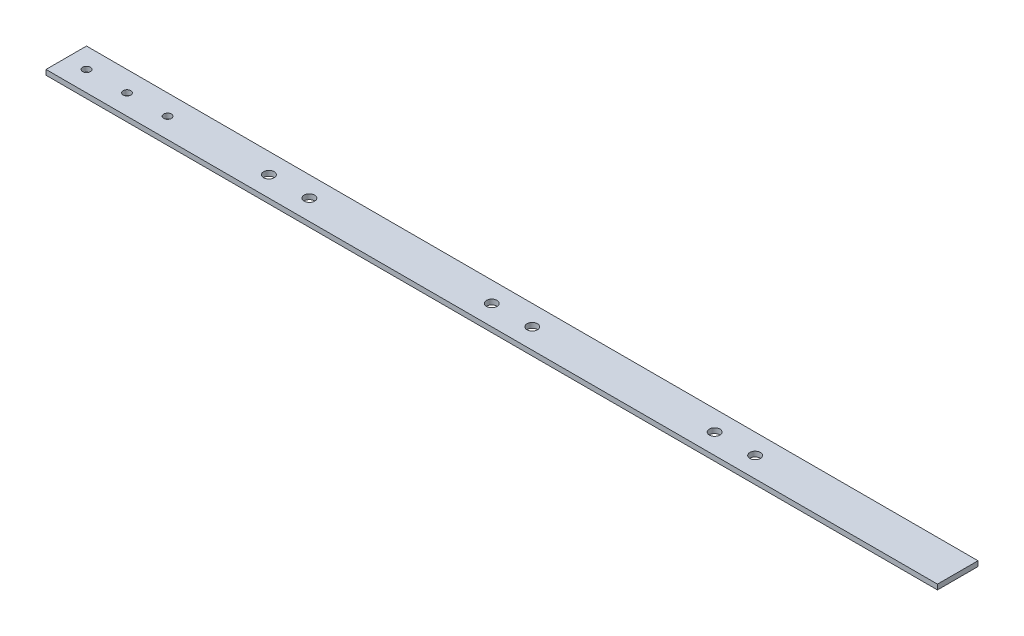
from build123d import *

# Parameters (mm, degrees)
SKETCH1_W           = 558.8
SKETCH1_H           = 25.4
BOSS_EXTRUDE1_DEPTH = 3.175
SKETCH2_R           = 2.413
CUT_EXTRUDE1_DEPTH  = 280.706508013
SKETCH3_R           = 3.302
CUT_EXTRUDE2_DEPTH  = 280.706508013


with BuildPart() as part:
    # Sketch1 → Boss-Extrude1 (new body)
    with BuildSketch(Plane(origin=(0, 0, 0), x_dir=(1, 0, 0), z_dir=(0, 1, 0))):
        Rectangle(SKETCH1_W, SKETCH1_H)
    extrude(amount=BOSS_EXTRUDE1_DEPTH)

    # Sketch2 → Cut-Extrude1 (cut, through all)
    with BuildSketch(Plane(origin=(0, 3.175, 0), x_dir=(1, 0, 0), z_dir=(0, 1, 0))):
        with Locations(Location((-266.7, 0, 0), (0, 0, 270))):
            Circle(SKETCH2_R)
        with Locations(Location((-241.3, 0, 0), (0, 0, 270))):
            Circle(SKETCH2_R)
        with Locations(Location((-215.9, 0, 0), (0, 0, 270))):
            Circle(SKETCH2_R)
    extrude(amount=-CUT_EXTRUDE1_DEPTH, mode=Mode.SUBTRACT)

    # Sketch3 → Cut-Extrude2 (cut, through all)
    with BuildSketch(Plane(origin=(0, 3.175, 0), x_dir=(1, 0, 0), z_dir=(0, 1, 0))):
        with Locations(Location((-152.4, 0, 0), (0, 0, 270))):
            Circle(SKETCH3_R)
        with Locations(Location((-127, 0, 0), (0, 0, 270))):
            Circle(SKETCH3_R)
        with Locations(Location((-12.7, 0, 0), (0, 0, 270))):
            Circle(SKETCH3_R)
        with Locations(Location((12.7, 0, 0), (0, 0, 270))):
            Circle(SKETCH3_R)
        with Locations(Location((127, 0, 0), (0, 0, 270))):
            Circle(SKETCH3_R)
        with Locations(Location((152.4, 0, 0), (0, 0, 270))):
            Circle(SKETCH3_R)
    extrude(amount=-CUT_EXTRUDE2_DEPTH, mode=Mode.SUBTRACT)


solid = part.part
